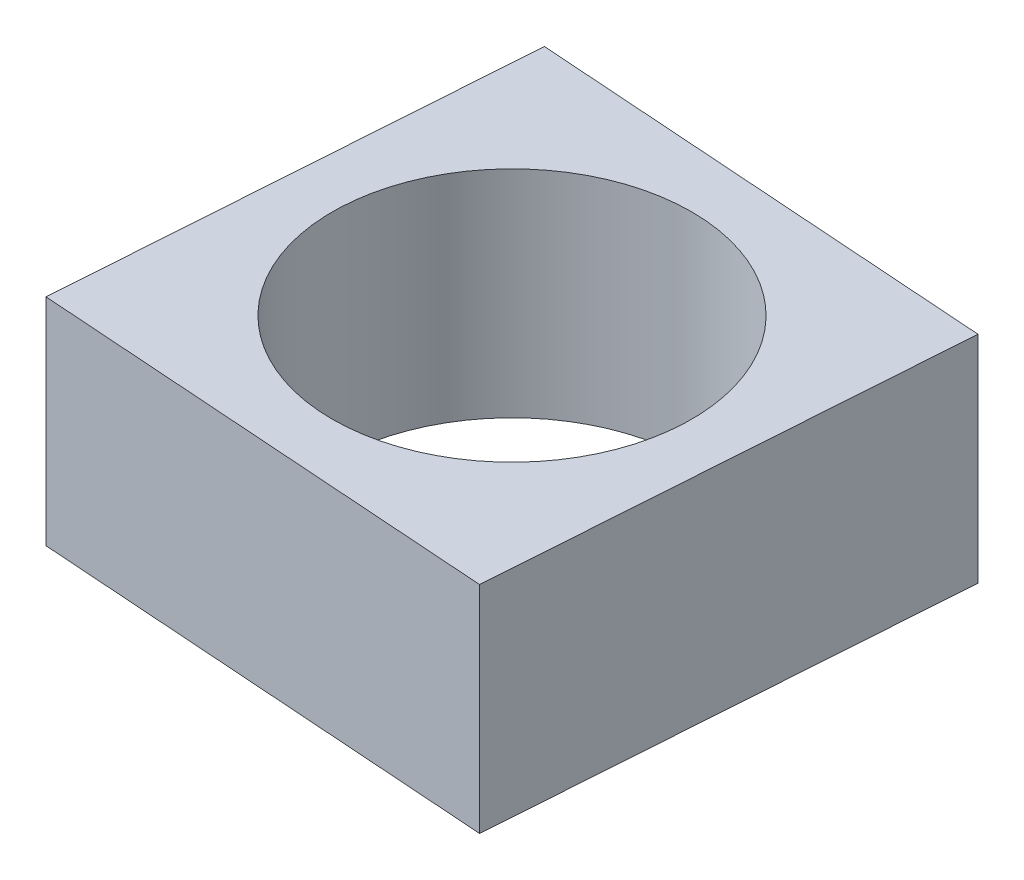
from build123d import *

# Parameters (mm, degrees)
BOSS_EXTRUDE1_DEPTH = 3
SKETCH3_R           = 2.5
CUT_EXTRUDE1_DEPTH  = 3


with BuildPart() as part:
    # Sketch2 → Boss-Extrude1 (new body)
    with BuildSketch(Plane(origin=(0, 0, 0), x_dir=(1, 0, 0), z_dir=(0, 1, 0))):
        Polygon((0, 0), (0.450772745, 6.484350695), (-6.03357795, 6.93512344), (-6.484350695, 0.450772745), align=None)
    extrude(amount=BOSS_EXTRUDE1_DEPTH)

    # Sketch3 → Cut-Extrude1 (cut)
    with BuildSketch(Plane(origin=(0, 3, 0), x_dir=(1, 0, 0), z_dir=(0, 1, 0))):
        with Locations(Location((-3.016788975, 3.46756172, 0), (0, 0, 270))):
            Circle(SKETCH3_R)
    extrude(amount=-CUT_EXTRUDE1_DEPTH, mode=Mode.SUBTRACT)


solid = part.part
